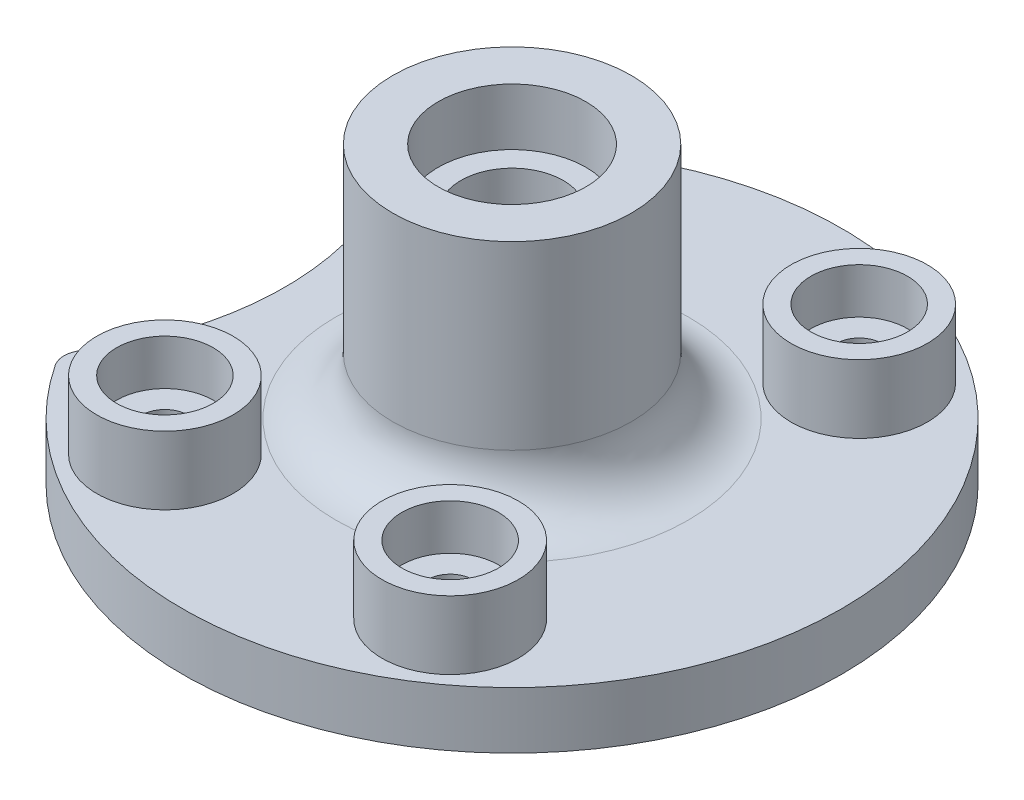
from build123d import *

# Parameters (mm, degrees)
ESQUISSE3_R             = 6.5
BOSS_EXTRU_1_DEPTH      = 5
CONG_1_R                = 5
ESQUISSE5_R             = 6
ESQUISSE5_R_2           = 4.25
BOSS_EXTRU_3_DEPTH      = 6
ESQUISSE8_R             = 4.25
BOSS_EXTRU_4_DEPTH      = 2
ESQUISSE6_R             = 2
ENL_V_MAT_EXTRU_1_DEPTH = 47.030533345
ESQUISSE7_R             = 3
ENL_V_MAT_EXTRU_2_DEPTH = 3
CONG_2_R                = 2


with BuildPart() as part:
    # Esquisse2 → Révolution1 (revolve)
    with BuildSketch(Plane(origin=(0, 0, 0), x_dir=(0, 0, -1), z_dir=(1, 0, 0))):
        Polygon((6.5, 5), (6.5, 10), (10.5, 10), (10.5, -10.9), (6.5, -10.9), (6.5, -5), (4.5, -5), (4.5, 0), (4.5, 5), align=None)
    revolve(axis=Axis((0, 0, 0), (0, 1, 0)))

    # Esquisse3 → Boss.-Extru.1 (add)
    with BuildSketch(Plane(origin=(0, -10.9, 0), x_dir=(1, 0, 0), z_dir=(0, 1, 0))):
        with BuildLine():
            ThreePointArc((-24.9, 14.865732407), (-20, 0), (-24.9, -14.865732407))
            ThreePointArc((-24.9, -14.865732407), (29, 0), (-24.9, 14.865732407))
        make_face()
        with Locations(Location((0, 0, 0), (0, 0, 90))):
            Circle(ESQUISSE3_R, mode=Mode.SUBTRACT)
    extrude(amount=-BOSS_EXTRU_1_DEPTH)

    # Congé1
    cong_1_edges = [part.edges().sort_by_distance(p)[0] for p in [
        (0, -10.9, 10.5),
    ]]
    fillet(cong_1_edges, radius=CONG_1_R)

    # Esquisse5 → Boss.-Extru.3 (add)
    # profile 1 of 2: a face of its own
    with BuildSketch(Plane(origin=(0, -10.9, 0), x_dir=(1, 0, 0), z_dir=(0, 1, 0))):
        with Locations(Location((-12.550755593, 17.998053071, 0), (0, 0, 90))):
            Circle(ESQUISSE5_R)
        with Locations(Location((-12.550755593, 17.998053071, 0), (0, 0, 270))):
            Circle(ESQUISSE5_R_2, mode=Mode.SUBTRACT)
    # profile 2 of 2: a face of its own
    with BuildSketch(Plane(origin=(0, -10.9, 0), x_dir=(1, 0, 0), z_dir=(0, 1, 0))):
        with Locations(Location((-12.550755593, -17.998053071, 0), (0, 0, 90))):
            Circle(ESQUISSE5_R)
        with Locations(Location((-12.550755593, -17.998053071, 0), (0, 0, 90))):
            Circle(ESQUISSE5_R_2, mode=Mode.SUBTRACT)
    boss_extru_3 = extrude(amount=BOSS_EXTRU_3_DEPTH)

    # Esquisse8 → Boss.-Extru.4 (add)
    with BuildSketch(Plane(origin=(0, -10.9, 0), x_dir=(1, 0, 0), z_dir=(0, 1, 0))):
        with Locations(Location((-12.550755593, -17.998053071, 0), (0, 0, 90))):
            Circle(ESQUISSE8_R)
        with Locations(Location((-12.550755593, 17.998053071, 0), (0, 0, 270))):
            Circle(ESQUISSE8_R)
    boss_extru_4 = extrude(amount=BOSS_EXTRU_4_DEPTH)

    # Esquisse6 → Enlèv. mat.-Extru.1 (cut, symmetric)
    with BuildSketch(Plane(origin=(0, -10.9, 0), x_dir=(1, 0, 0), z_dir=(0, 1, 0))):
        with Locations(Location((-12.550755593, -17.998053071, 0), (0, 0, 270))):
            Circle(ESQUISSE6_R)
        with Locations(Location((-12.550755593, 17.998053071, 0), (0, 0, 270))):
            Circle(ESQUISSE6_R)
    enl_v_mat_extru_1 = extrude(amount=ENL_V_MAT_EXTRU_1_DEPTH, both=True, mode=Mode.SUBTRACT)

    # Esquisse7 → Enlèv. mat.-Extru.2 (cut)
    with BuildSketch(Plane.XZ.offset(15.9)):
        with Locations(Location((-12.550755593, 17.998053071, 0), (0, 0, 270))):
            Circle(ESQUISSE7_R)
        with Locations(Location((-12.550755593, -17.998053071, 0), (0, 0, 270))):
            Circle(ESQUISSE7_R)
    enl_v_mat_extru_2 = extrude(amount=-ENL_V_MAT_EXTRU_2_DEPTH, mode=Mode.SUBTRACT)

    # Congé2
    cong_2_edges = [part.edges().sort_by_distance(p)[0] for p in [
        (-24.9, -13.4, -14.865732407),
        (-24.9, -13.4, 14.865732407),
    ]]
    fillet(cong_2_edges, radius=CONG_2_R)

    # Symétrie1: Boss.-Extru.3, Boss.-Extru.4, Enlèv. mat.-Extru.1, Enlèv. mat.-Extru.2 across plane
    add(boss_extru_3.mirror(Plane(origin=(0, 0, 0), x_dir=(0, 0, 1), z_dir=(1, 0, 0))))
    add(boss_extru_4.mirror(Plane(origin=(0, 0, 0), x_dir=(0, 0, 1), z_dir=(1, 0, 0))))
    add(enl_v_mat_extru_1.mirror(Plane(origin=(0, 0, 0), x_dir=(0, 0, 1), z_dir=(1, 0, 0))), mode=Mode.SUBTRACT)
    add(enl_v_mat_extru_2.mirror(Plane(origin=(0, 0, 0), x_dir=(0, 0, 1), z_dir=(1, 0, 0))), mode=Mode.SUBTRACT)


solid = part.part
